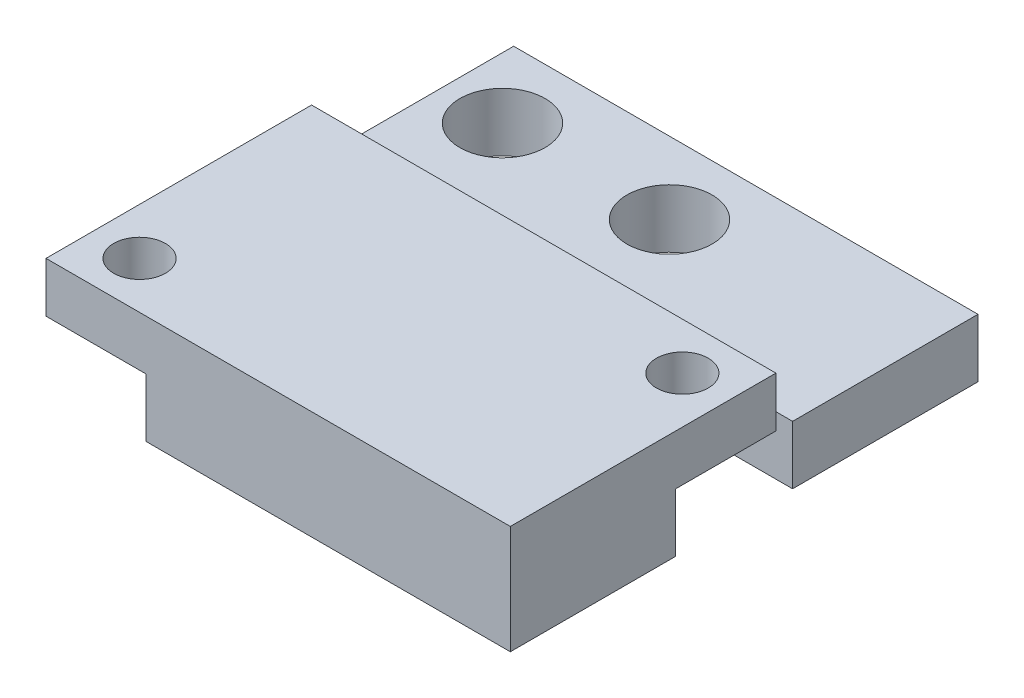
from build123d import *

# Parameters (mm, degrees)
SKETCH1_W           = 27.8
SKETCH1_H           = 28
SKETCH1_R           = 2.55
BOSS_EXTRUDE1_DEPTH = 3.5
SKETCH2_W           = 27.8
SKETCH2_H           = 15.9
SKETCH2_R           = 1.55
BOSS_EXTRUDE2_DEPTH = 3
SKETCH3_W           = 6
SKETCH3_H           = 6
CUT_EXTRUDE5_DEPTH  = 3.5
SKETCH4_W           = 6
SKETCH4_H           = 6
SKETCH4_H_2         = 1
CUT_EXTRUDE7_DEPTH  = 3.5
SKETCH5_R           = 2.55
SKETCH5_R_2         = 5
CUT_EXTRUDE8_DEPTH  = 3


with BuildPart() as part:
    # Sketch1 → Boss-Extrude1 (new body)
    with BuildSketch(Plane(origin=(0, 0, 0), x_dir=(1, 0, 0), z_dir=(0, 1, 0))):
        with Locations((13.9, 14)):
            Rectangle(SKETCH1_W, SKETCH1_H)
        with Locations(Location((13.65, 23.68, 0), (0, 0, 270))):
            Circle(SKETCH1_R, mode=Mode.SUBTRACT)
        with Locations(Location((3.65, 23.68, 0), (0, 0, 270))):
            Circle(SKETCH1_R, mode=Mode.SUBTRACT)
    extrude(amount=BOSS_EXTRUDE1_DEPTH)

    # Sketch2 → Boss-Extrude2 (add)
    with BuildSketch(Plane(origin=(0, 3.5, 0), x_dir=(1, 0, 0), z_dir=(0, 1, 0))):
        with Locations((13.9, 7.95)):
            Rectangle(SKETCH2_W, SKETCH2_H)
        with Locations(Location((2.8, 2.8, 0), (0, 0, 270))):
            Circle(SKETCH2_R, mode=Mode.SUBTRACT)
        with Locations(Location((25, 13.1, 0), (0, 0, 270))):
            Circle(SKETCH2_R, mode=Mode.SUBTRACT)
    extrude(amount=BOSS_EXTRUDE2_DEPTH)

    # Sketch3 → Cut-Extrude5 (cut)
    with BuildSketch(Plane.XZ):
        with Locations((3, -3)):
            Rectangle(SKETCH3_W, SKETCH3_H)
    extrude(amount=-CUT_EXTRUDE5_DEPTH, mode=Mode.SUBTRACT)

    # Sketch4 → Cut-Extrude7 (cut)
    with BuildSketch(Plane.XZ):
        with Locations((24.8, -12.9)):
            Rectangle(SKETCH4_W, SKETCH4_H)
        with Locations((24.8, -16.4)):
            Rectangle(SKETCH4_W, SKETCH4_H_2)
    extrude(amount=-CUT_EXTRUDE7_DEPTH, mode=Mode.SUBTRACT)

    # Sketch5 → Cut-Extrude8 (cut)
    with BuildSketch(Plane.XZ):
        with Locations(Location((13.65, -23.68, 0), (0, 0, 90))):
            Circle(SKETCH5_R)
        with Locations(Location((13.65, -13.68, 0), (0, 0, 270))):
            Circle(SKETCH5_R_2)
    extrude(amount=-CUT_EXTRUDE8_DEPTH, mode=Mode.SUBTRACT)


solid = part.part
